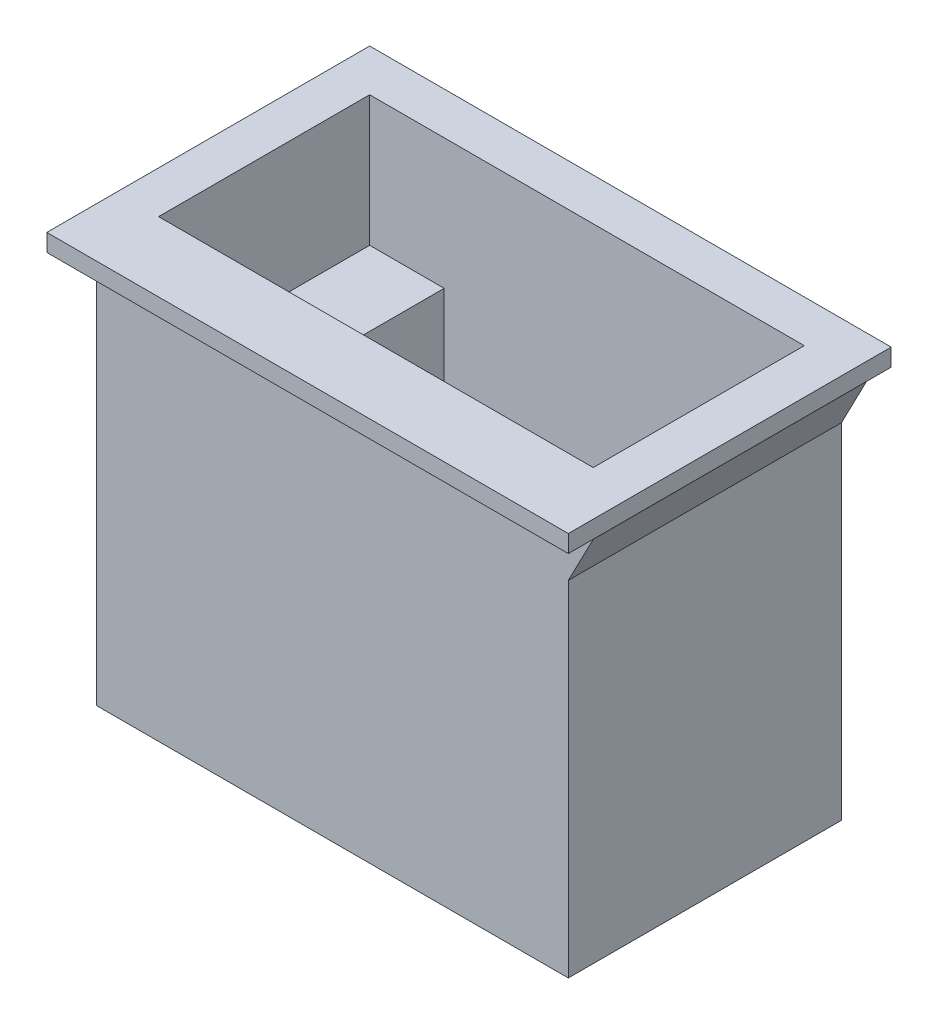
from build123d import *

# Parameters (mm, degrees)
SKETCH1_W           = 38
SKETCH1_H           = 22
BOSS_EXTRUDE1_DEPTH = 33
SKETCH2_W           = 35
SKETCH2_H           = 17
CUT_EXTRUDE1_DEPTH  = 28
SKETCH3_W           = 6
SKETCH3_H           = 17
BOSS_EXTRUDE2_DEPTH = 17.5
SKETCH4_W           = 42
SKETCH4_H           = 26
SKETCH4_W_2         = 38
SKETCH4_H_2         = 22
EXTRUDE_THIN2_DEPTH = 1.4
SKETCH5_R           = 1
CUT_EXTRUDE2_DEPTH  = 3
SKETCH6_R           = 1
CUT_EXTRUDE3_DEPTH  = 3
SKETCH7_W           = 9.4
SKETCH7_H           = 4.5
CUT_EXTRUDE4_DEPTH  = 10
SKETCH8_W           = 20
SKETCH8_H           = 10
CUT_EXTRUDE5_DEPTH  = 1.5
SKETCH9_R           = 3.7
SKETCH9_R_2         = 1
CUT_EXTRUDE6_DEPTH  = 1.7
FILLET1_R           = 4
BOSS_EXTRUDE3_START = -22
BOSS_EXTRUDE3_DEPTH = 22
FILLET2_R           = 3


with BuildPart() as part:
    # Sketch1 → Boss-Extrude1 (new body)
    with BuildSketch(Plane(origin=(0, 0, 0), x_dir=(1, 0, 0), z_dir=(0, 1, 0))):
        with Locations((8.6, -5.057142857)):
            Rectangle(SKETCH1_W, SKETCH1_H)
    extrude(amount=BOSS_EXTRUDE1_DEPTH)

    # Sketch2 → Cut-Extrude1 (cut)
    with BuildSketch(Plane(origin=(0, 33, 0), x_dir=(1, 0, 0), z_dir=(0, 1, 0))):
        with Locations((8.5, -3.957142857)):
            Rectangle(SKETCH2_W, SKETCH2_H)
    extrude(amount=-CUT_EXTRUDE1_DEPTH, mode=Mode.SUBTRACT)

    # Sketch3 → Boss-Extrude2 (add)
    with BuildSketch(Plane(origin=(0, 5, 0), x_dir=(1, 0, 0), z_dir=(0, 1, 0))):
        with Locations((-6, -3.957142857)):
            Rectangle(SKETCH3_W, SKETCH3_H)
        with Locations((23, -3.957142857)):
            Rectangle(SKETCH3_W, SKETCH3_H)
    extrude(amount=BOSS_EXTRUDE2_DEPTH)

    # Sketch4 → Extrude-Thin2 (add)
    with BuildSketch(Plane(origin=(0, 33, 0), x_dir=(1, 0, 0), z_dir=(0, 1, 0))):
        with Locations((8.6, -5.057142857)):
            Rectangle(SKETCH4_W, SKETCH4_H)
        with Locations((8.6, -5.057142857)):
            Rectangle(SKETCH4_W_2, SKETCH4_H_2, mode=Mode.SUBTRACT)
    extrude(amount=-EXTRUDE_THIN2_DEPTH)

    # Sketch5 → Cut-Extrude2 (cut)
    with BuildSketch(Plane(origin=(0, 22.5, 0), x_dir=(1, 0, 0), z_dir=(0, 1, 0))):
        with Locations(Location((-5.5, -3.892148731, 0), (0, 0, 270))):
            Circle(SKETCH5_R)
    extrude(amount=-CUT_EXTRUDE2_DEPTH, mode=Mode.SUBTRACT)

    # Sketch6 → Cut-Extrude3 (cut)
    with BuildSketch(Plane(origin=(0, 22.5, 0), x_dir=(1, 0, 0), z_dir=(0, 1, 0))):
        with Locations(Location((22.953148274, -4.115727136, 0), (0, 0, 270))):
            Circle(SKETCH6_R)
    extrude(amount=-CUT_EXTRUDE3_DEPTH, mode=Mode.SUBTRACT)

    # Sketch7 → Cut-Extrude4 (cut)
    with BuildSketch(Plane(origin=(-3, 0, 0), x_dir=(0, 0, -1), z_dir=(1, 0, 0))):
        with Locations((-3.757142857, 6.291369126)):
            Rectangle(SKETCH7_W, SKETCH7_H)
    extrude(amount=-CUT_EXTRUDE4_DEPTH, mode=Mode.SUBTRACT)

    # Sketch8 → Cut-Extrude5 (cut)
    with BuildSketch(Plane(origin=(0, 5, 0), x_dir=(1, 0, 0), z_dir=(0, 1, 0))):
        with Locations((8.592117784, -3.72787339)):
            Rectangle(SKETCH8_W, SKETCH8_H)
    extrude(amount=-CUT_EXTRUDE5_DEPTH, mode=Mode.SUBTRACT)

    # Sketch9 → Cut-Extrude6 (cut)
    with BuildSketch(Plane(origin=(0, 3.5, 0), x_dir=(1, 0, 0), z_dir=(0, 1, 0))):
        with Locations(Location((8.808284604, -3.634888569, 0), (0, 0, 270))):
            Circle(SKETCH9_R)
        with Locations(Location((1.608284604, -3.634888569, 0), (0, 0, 270))):
            Circle(SKETCH9_R_2)
        with Locations(Location((16.008284604, -3.634888569, 0), (0, 0, 270))):
            Circle(SKETCH9_R_2)
    extrude(amount=-CUT_EXTRUDE6_DEPTH, mode=Mode.SUBTRACT)

    # Fillet1
    fillet1_edges = [part.edges().sort_by_distance(p)[0] for p in [
        (-1.407882216, 4.25, 8.72787339),
        (-1.407882216, 4.25, -1.27212661),
        (18.592117784, 4.25, -1.27212661),
        (18.592117784, 4.25, 8.72787339),
    ]]
    fillet(fillet1_edges, radius=FILLET1_R)

    # Sketch10 → Boss-Extrude3 (add)
    with BuildSketch(Plane.XY.offset(16.057142857).offset(BOSS_EXTRUDE3_START)):
        Polygon((27.6, 31.6), (29.607360767, 31.6), (27.6, 27.732810295), align=None)
    extrude(amount=BOSS_EXTRUDE3_DEPTH)

    # Fillet2
    fillet2_edges = [part.edges().sort_by_distance(p)[0] for p in [
        (-3, 8.541369126, 3.757142857),
    ]]
    fillet(fillet2_edges, radius=FILLET2_R)


solid = part.part
